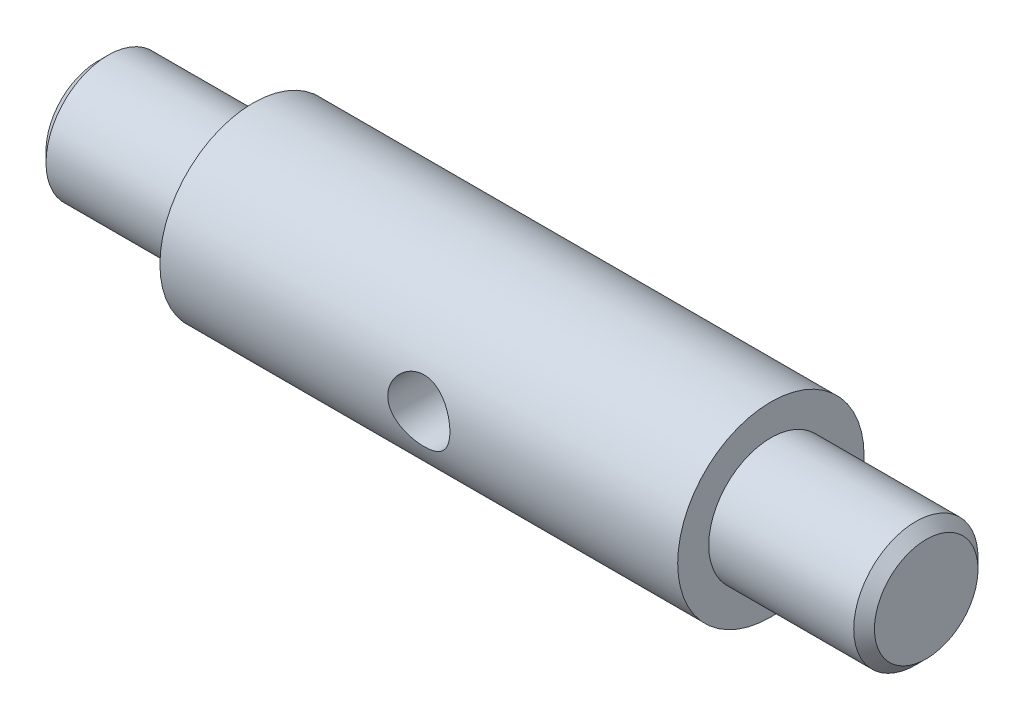
from build123d import *

# Parameters (mm, degrees)
CUT_EXTRUDE3_DEPTH           = 50.658836072
CUT_EXTRUDE3_DEPTH_BACK      = 50.658836072
SKETCH2_R                    = 3
CHAMFER1_SIZE                = 1
F_6_0_6_DIAMETER_HOLE1_D     = 6
F_6_0_6_DIAMETER_HOLE1_DEPTH = 45
F_6_0_6_DIAMETER_HOLE1_TIP   = 1.802581857


with BuildPart() as part:
    # Sketch1 → Revolve5 (revolve)
    with BuildSketch(Plane.XY, mode=Mode.PRIVATE) as revolve5_sk:
        Polygon((-32, 0), (48, 0), (48, 6), (33, 6), (33, 9), (-17, 9), (-17, 6), (-32, 6), align=None)
    revolve(revolve5_sk.sketch.rotate(Axis((-32, 0, 0), (1, 0, 0)), 90), axis=Axis((-32, 0, 0), (1, 0, 0)))

    # Sketch2 → Cut-Extrude3 (cut, two sides: drawn at the far end of the back side and taken through both)
    with BuildSketch(Plane.XY.offset(-CUT_EXTRUDE3_DEPTH_BACK)):
        with Locations((8, 0)):
            Circle(SKETCH2_R)
    extrude(amount=CUT_EXTRUDE3_DEPTH + CUT_EXTRUDE3_DEPTH_BACK, mode=Mode.SUBTRACT)

    # Chamfer1
    chamfer1_edges = [part.edges().sort_by_distance(p)[0] for p in [
        (-32, 0, -6),
        (48, 0, -6),
    ]]
    chamfer(chamfer1_edges, length=CHAMFER1_SIZE)

    # Ø6.0 (6) Diameter Hole1
    with Locations(Plane.ZY.offset(32)):
        with Locations((0, 0)):
            Hole(F_6_0_6_DIAMETER_HOLE1_D / 2, depth=F_6_0_6_DIAMETER_HOLE1_DEPTH)
            with Locations((0, 0, -(F_6_0_6_DIAMETER_HOLE1_DEPTH + F_6_0_6_DIAMETER_HOLE1_TIP / 2))):  # 118° drill point
                Cone(0, F_6_0_6_DIAMETER_HOLE1_D / 2, F_6_0_6_DIAMETER_HOLE1_TIP, mode=Mode.SUBTRACT)


solid = part.part
